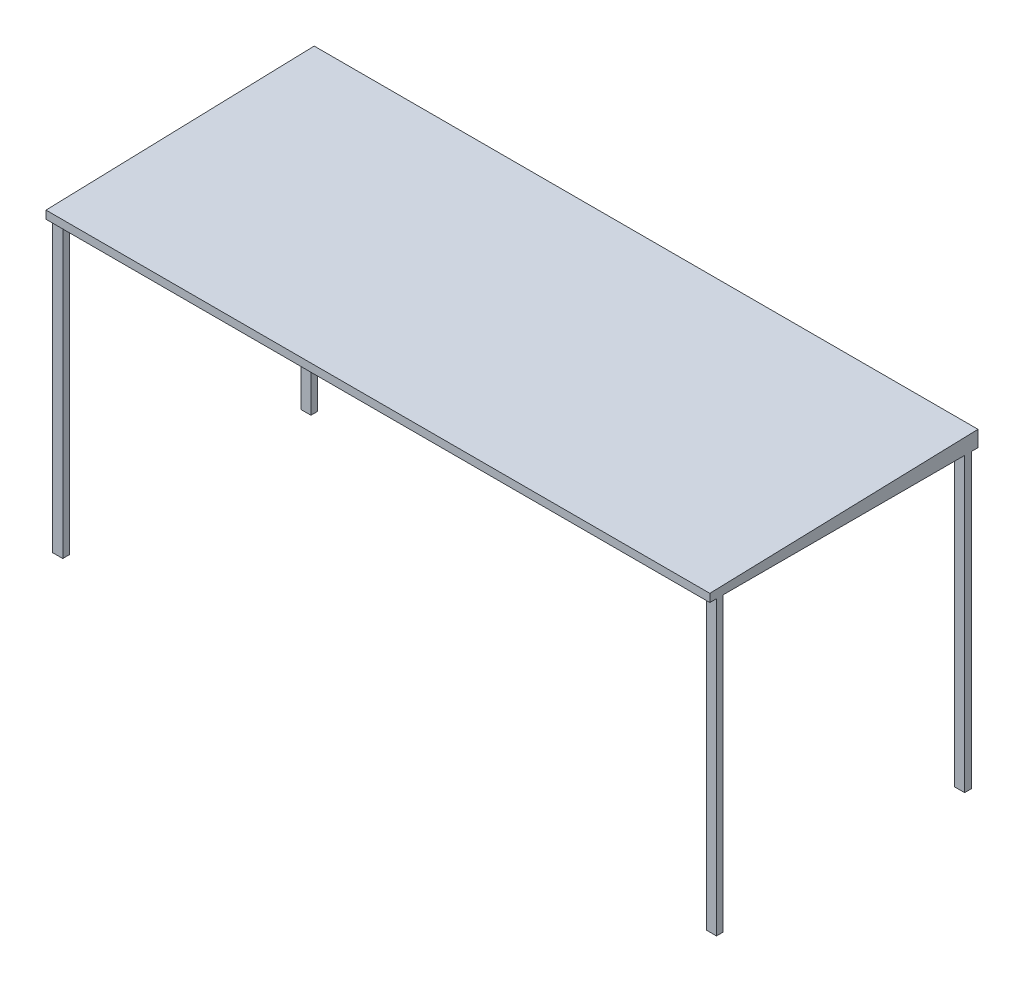
from build123d import *

# Parameters (mm, degrees)
CROQUIS2_W                = 76.2
CROQUIS2_H                = 50.8
SALIENTE_EXTRUIR1_DEPTH   = 2200
SALIENTE_EXTRUIR1_2_DEPTH = 2200
SALIENTE_EXTRUIR1_3_DEPTH = 2200
SALIENTE_EXTRUIR1_4_DEPTH = 2200
SALIENTE_EXTRUIR2_DEPTH   = 5000


with BuildPart() as part:
    # Croquis2 → Saliente-Extruir1 (new body)
    with BuildSketch(Plane(origin=(0, 0, 0), x_dir=(1, 0, 0), z_dir=(0, 1, 0))):
        with Locations((38.1, -25.4)):
            Rectangle(CROQUIS2_W, CROQUIS2_H)
    extrude(amount=SALIENTE_EXTRUIR1_DEPTH)



with BuildPart() as body_2:
    # Croquis2 → Saliente-Extruir1 2 (new body)
    with BuildSketch(Plane(origin=(0, 0, 0), x_dir=(1, 0, 0), z_dir=(0, 1, 0))):
        with Locations((4961.9, -25.4)):
            Rectangle(CROQUIS2_W, CROQUIS2_H)
    extrude(amount=SALIENTE_EXTRUIR1_2_DEPTH)


with BuildPart() as body_3:
    # Croquis2 → Saliente-Extruir1 3 (new body)
    with BuildSketch(Plane(origin=(0, 0, 0), x_dir=(1, 0, 0), z_dir=(0, 1, 0))):
        with Locations((4961.9, -1894.6)):
            Rectangle(CROQUIS2_W, CROQUIS2_H)
    extrude(amount=SALIENTE_EXTRUIR1_3_DEPTH)


with BuildPart() as body_4:
    # Croquis2 → Saliente-Extruir1 4 (new body)
    with BuildSketch(Plane(origin=(0, 0, 0), x_dir=(1, 0, 0), z_dir=(0, 1, 0))):
        with Locations((38.1, -1894.6)):
            Rectangle(CROQUIS2_W, CROQUIS2_H)
    extrude(amount=SALIENTE_EXTRUIR1_4_DEPTH)


with BuildPart() as part_1:
    add(part.part)

    add(body_2.part)  # Saliente-Extruir2 merges body 2

    add(body_3.part)  # Saliente-Extruir2 merges body 3

    add(body_4.part)  # Saliente-Extruir2 merges body 4
    # Croquis3 → Saliente-Extruir2 (add)
    with BuildSketch(Plane(origin=(5000, 0, 0), x_dir=(0, 0, -1), z_dir=(1, 0, 0))):
        Polygon((-1970, 2200), (50, 2200), (50, 2320), (-1970, 2260), align=None)
    extrude(amount=-SALIENTE_EXTRUIR2_DEPTH)


solid = part_1.part
